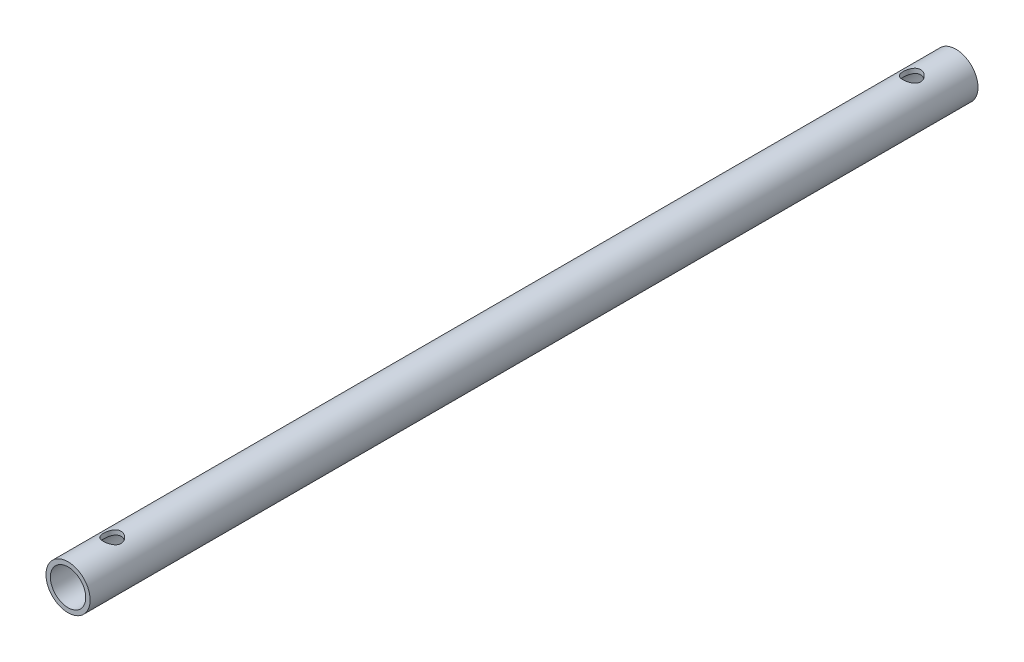
from build123d import *

# Parameters (mm, degrees)
SKETCH_1_R               = 5
SKETCH_1_R_2             = 4
EXTRUDE_1_DEPTH          = 100.5
CUT_EXTRUDE_1_DEPTH      = 101.74844912
CUT_EXTRUDE_1_DEPTH_BACK = 101.74844912
SKETCH_2_R               = 2


with BuildPart() as part:
    # 草图1 → 凸台-拉伸1 (new, symmetric)
    with BuildSketch(Plane.XY):
        Circle(SKETCH_1_R)
        Circle(SKETCH_1_R_2, mode=Mode.SUBTRACT)
    extrude(amount=EXTRUDE_1_DEPTH, both=True)

    # 草图2 → 切除-拉伸1 (cut, two sides: drawn at the far end of the back side and taken through both)
    with BuildSketch(Plane(origin=(0, 0, 0), x_dir=(1, 0, 0), z_dir=(0, 1, 0)).offset(-CUT_EXTRUDE_1_DEPTH_BACK)):
        with Locations(Location((0, -90.5, 0), (0, 0, 270))):
            Circle(SKETCH_2_R)
        with Locations(Location((0, 90.5, 0), (0, 0, 270))):
            Circle(SKETCH_2_R)
    extrude(amount=CUT_EXTRUDE_1_DEPTH + CUT_EXTRUDE_1_DEPTH_BACK, mode=Mode.SUBTRACT)


solid = part.part
